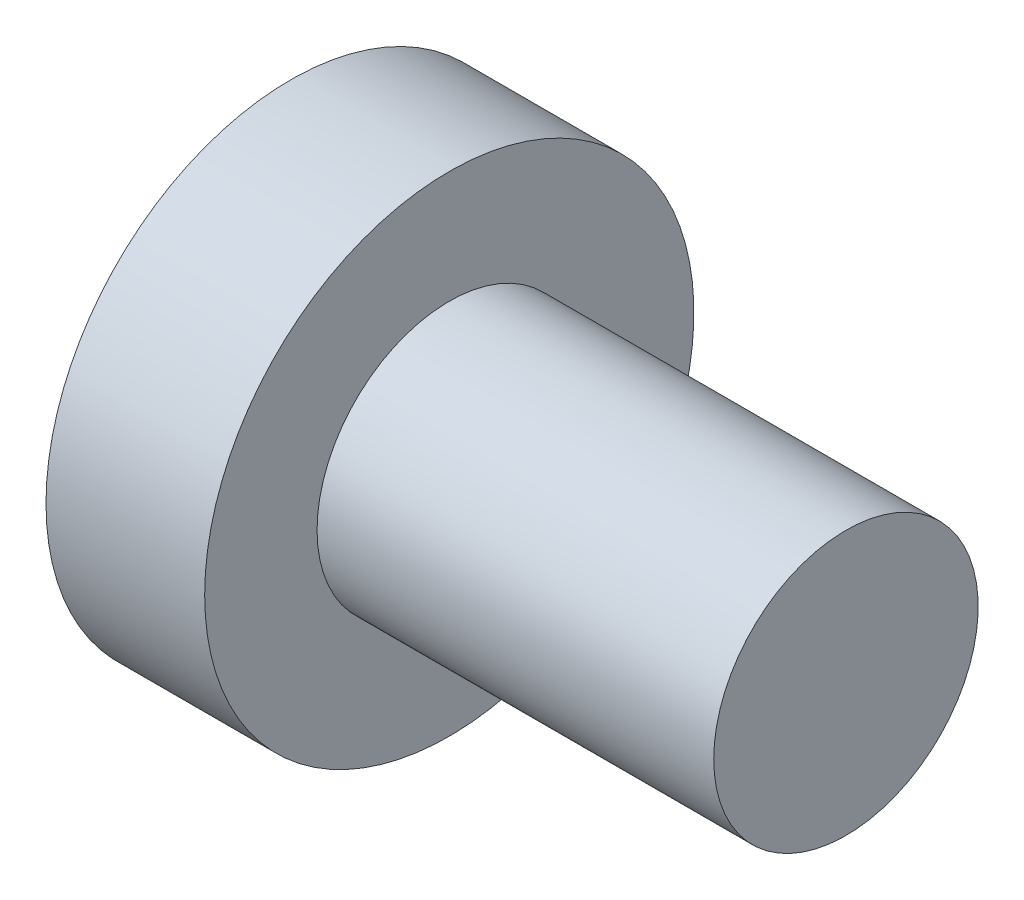
from build123d import *


with BuildPart() as part:
    # ｽｹｯﾁ1 → Revolve 390 (revolve)
    with BuildSketch(Plane.XY, mode=Mode.PRIVATE) as revolve_390_sk:
        Polygon((-6, 0), (-6, 9.25), (0, 9.25), (0, 5), (15, 5), (15, 0), align=None)
    revolve(revolve_390_sk.sketch.rotate(Axis((0, 0, 0), (1, 0, 0)), 90), axis=Axis((0, 0, 0), (1, 0, 0)))


solid = part.part
